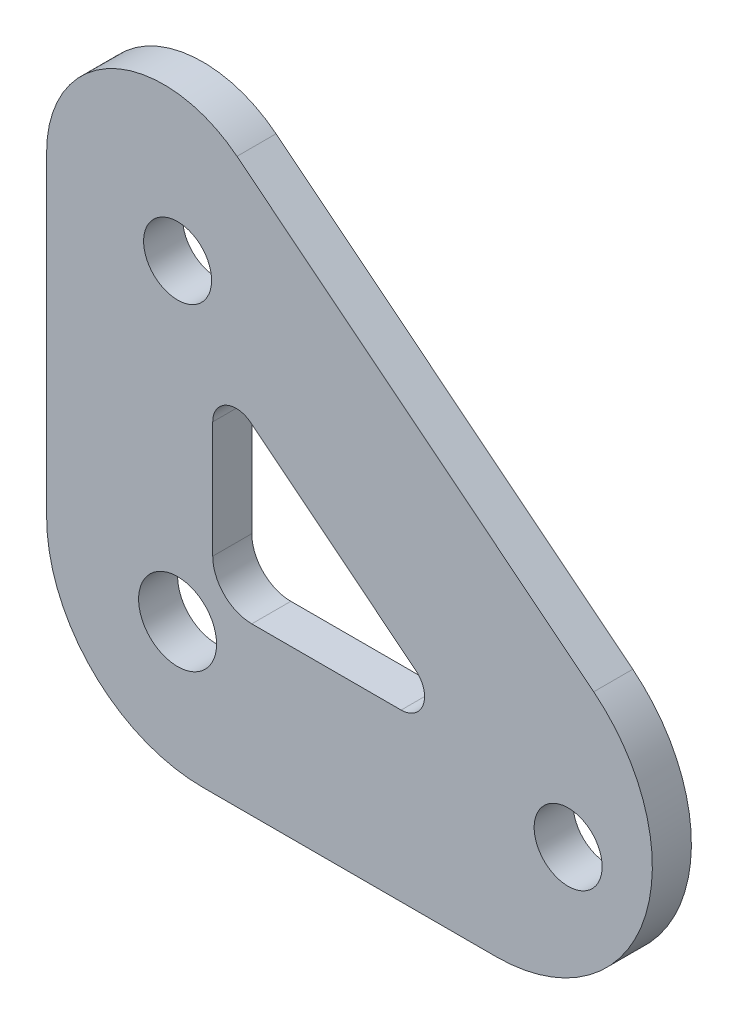
from build123d import *

# Parameters (mm, degrees)
SKETCH1_R           = 4.35
SKETCH1_R_2         = 4.99
BOSS_EXTRUDE1_DEPTH = 5
FILLET1_R           = 15
FILLET2_R           = 20
FILLET3_R           = 20
CUT_EXTRUDE1_DEPTH  = 109.301776601
FILLET4_R           = 5
FILLET5_R           = 3
FILLET6_R           = 3


with BuildPart() as part:
    # Sketch1 → Boss-Extrude1 (new body)
    with BuildSketch(Plane.XY):
        Polygon((0, 91.64845728), (0, 0), (114.5605716, 0), align=None)
        with Locations((16.765578361, 56.765578361)):
            Circle(SKETCH1_R, mode=Mode.SUBTRACT)
        with Locations((66.765578361, 16.765578361)):
            Circle(SKETCH1_R, mode=Mode.SUBTRACT)
        with Locations((16.765578361, 16.765578361)):
            Circle(SKETCH1_R_2, mode=Mode.SUBTRACT)
    extrude(amount=BOSS_EXTRUDE1_DEPTH)

    # Fillet1
    fillet1_edges = [part.edges().sort_by_distance(p)[0] for p in [
        (0, 91.64845728, 2.5),
    ]]
    fillet(fillet1_edges, radius=FILLET1_R)

    # Fillet2
    fillet2_edges = [part.edges().sort_by_distance(p)[0] for p in [
        (0, 0, 2.5),
    ]]
    fillet(fillet2_edges, radius=FILLET2_R)

    # Fillet3
    fillet3_edges = [part.edges().sort_by_distance(p)[0] for p in [
        (114.5605716, 0, 2.5),
    ]]
    fillet(fillet3_edges, radius=FILLET3_R)

    # Sketch2 → Cut-Extrude1 (cut, through all)
    with BuildSketch(Plane.XY.offset(5)):
        Polygon((21.265578361, 47.402766547), (53.937063594, 21.265578361), (21.265578361, 21.265578361), align=None)
    extrude(amount=-CUT_EXTRUDE1_DEPTH, mode=Mode.SUBTRACT)

    # Fillet4
    fillet4_edges = [part.edges().sort_by_distance(p)[0] for p in [
        (21.265578361, 21.265578361, 2.5),
    ]]
    fillet(fillet4_edges, radius=FILLET4_R)

    # Fillet5
    fillet5_edges = [part.edges().sort_by_distance(p)[0] for p in [
        (21.265578361, 47.402766547, 2.5),
    ]]
    fillet(fillet5_edges, radius=FILLET5_R)

    # Fillet6
    fillet6_edges = [part.edges().sort_by_distance(p)[0] for p in [
        (53.937063594, 21.265578361, 2.5),
    ]]
    fillet(fillet6_edges, radius=FILLET6_R)


solid = part.part
